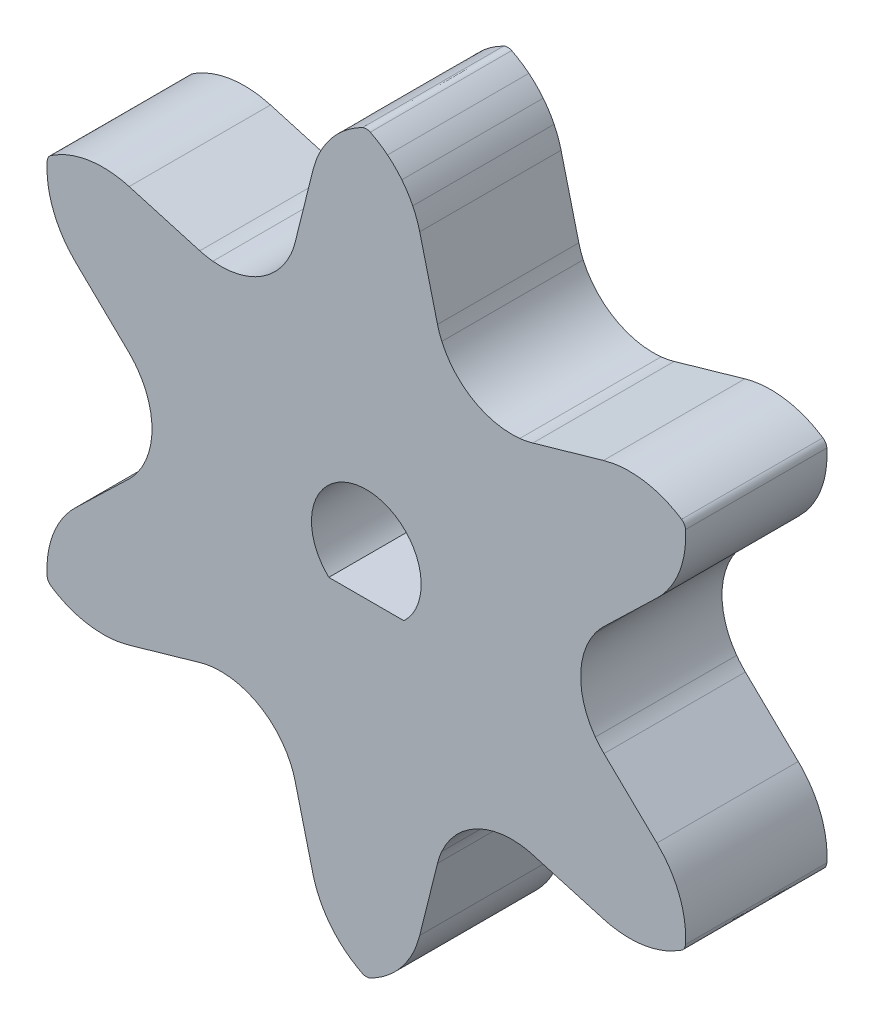
from build123d import *

# Parameters (mm, degrees)
BOSS_EXTRUDE1_DEPTH = 4.7625
BOSS_EXTRUDE2_START = -4.7625
BOSS_EXTRUDE2_DEPTH = 4.7625


with BuildPart() as part:
    # Sketch1 → Boss-Extrude1 (new body)
    with BuildSketch(Plane.XY):
        with BuildLine():
            Line((-9.507346898, -10.258391726), (-8.908113007, -12.661787593))
            ThreePointArc((-8.908113007, -12.661787593), (-8.303157018, -13.881491249), (-7.2429575, -14.735672577))
            ThreePointArc((-7.2429575, -14.735672577), (-7.10920631, -14.767138372), (-6.975455121, -14.735672577))
            ThreePointArc((-6.975455121, -14.735672577), (-5.915255603, -13.881491249), (-5.310299614, -12.661787593))
            Line((-5.310299614, -12.661787593), (-4.711065722, -10.258391726))
            ThreePointArc((-4.711065722, -10.258391726), (-4.647570891, -10.043856855), (-4.565714834, -9.835634882))
            ThreePointArc((-4.565714834, -9.835634882), (-3.49859631, -8.649390472), (-1.937719254, -8.318360926))
            ThreePointArc((-1.937719254, -8.318360926), (-1.716465707, -8.351582488), (-1.498925643, -8.403861787))
            Line((-1.498925643, -8.403861787), (0.882093179, -9.086607947))
            ThreePointArc((0.882093179, -9.086607947), (2.240865525, -9.172552521), (3.510708013, -8.681483469))
            ThreePointArc((3.510708013, -8.681483469), (3.604833786, -8.581384439), (3.644459203, -8.449819613))
            ThreePointArc((3.644459203, -8.449819613), (3.434816232, -7.104569234), (2.680999875, -5.970810151))
            Line((2.680999875, -5.970810151), (0.899214945, -4.250160445))
            ThreePointArc((0.899214945, -4.250160445), (0.745169712, -4.087904873), (0.605772222, -3.912904461))
            ThreePointArc((0.605772222, -3.912904461), (0.11201369, -2.395630505), (0.605772222, -0.878356549))
            ThreePointArc((0.605772222, -0.878356549), (0.745169712, -0.703356138), (0.899214945, -0.541100566))
            Line((0.899214945, -0.541100566), (2.680999444, 1.179548724))
            ThreePointArc((2.680999444, 1.179548724), (3.434816124, 2.313307944), (3.644459203, 3.658558603))
            ThreePointArc((3.644459203, 3.658558603), (3.604833786, 3.790123428), (3.510708013, 3.890222459))
            ThreePointArc((3.510708013, 3.890222459), (2.240865525, 4.38129151), (0.882093179, 4.295346937))
            Line((0.882093179, 4.295346937), (-1.498925643, 3.612600776))
            ThreePointArc((-1.498925643, 3.612600776), (-1.716465707, 3.560321477), (-1.937719254, 3.527099916))
            ThreePointArc((-1.937719254, 3.527099916), (-3.49859631, 3.858129461), (-4.565714834, 5.044373871))
            ThreePointArc((-4.565714834, 5.044373871), (-4.647570891, 5.252595845), (-4.711065722, 5.467130715))
            Line((-4.711065722, 5.467130715), (-5.310299614, 7.870526582))
            ThreePointArc((-5.310299614, 7.870526582), (-5.915255603, 9.090230239), (-6.975455121, 9.944411567))
            ThreePointArc((-6.975455121, 9.944411567), (-7.10920631, 9.975877362), (-7.2429575, 9.944411567))
            ThreePointArc((-7.2429575, 9.944411567), (-8.303157018, 9.090230239), (-8.908113007, 7.870526582))
            Line((-8.908113007, 7.870526582), (-9.507346898, 5.467130715))
            ThreePointArc((-9.507346898, 5.467130715), (-9.570841729, 5.252595845), (-9.652697786, 5.044373871))
            ThreePointArc((-9.652697786, 5.044373871), (-10.71981631, 3.858129461), (-12.280693367, 3.527099916))
            ThreePointArc((-12.280693367, 3.527099916), (-12.501946914, 3.560321477), (-12.719486977, 3.612600776))
            Line((-12.719486977, 3.612600776), (-15.100505799, 4.295346937))
            ThreePointArc((-15.100505799, 4.295346937), (-16.459278145, 4.38129151), (-17.729120634, 3.890222459))
            ThreePointArc((-17.729120634, 3.890222459), (-17.823246406, 3.790123428), (-17.862871823, 3.658558603))
            ThreePointArc((-17.862871823, 3.658558603), (-17.653228853, 2.313308223), (-16.899412496, 1.17954914))
            Line((-16.899412496, 1.17954914), (-15.117627565, -0.541100566))
            ThreePointArc((-15.117627565, -0.541100566), (-14.963582333, -0.703356138), (-14.824184843, -0.878356549))
            ThreePointArc((-14.824184843, -0.878356549), (-14.33042631, -2.395630505), (-14.824184843, -3.912904461))
            ThreePointArc((-14.824184843, -3.912904461), (-14.963582333, -4.087904873), (-15.117627565, -4.250160445))
            Line((-15.117627565, -4.250160445), (-16.899412065, -5.970809735))
            ThreePointArc((-16.899412065, -5.970809735), (-17.653228744, -7.104568955), (-17.862871823, -8.449819613))
            ThreePointArc((-17.862871823, -8.449819613), (-17.823246406, -8.581384439), (-17.729120634, -8.681483469))
            ThreePointArc((-17.729120634, -8.681483469), (-16.459278145, -9.172552521), (-15.100505799, -9.086607947))
            Line((-15.100505799, -9.086607947), (-12.719486977, -8.403861787))
            ThreePointArc((-12.719486977, -8.403861787), (-12.501946914, -8.351582488), (-12.280693367, -8.318360926))
            ThreePointArc((-12.280693367, -8.318360926), (-10.71981631, -8.649390472), (-9.652697786, -9.835634882))
            ThreePointArc((-9.652697786, -9.835634882), (-9.570841729, -10.043856855), (-9.507346898, -10.258391726))
        make_face()
        with BuildLine():
            Line((-5.795813757, -3.870630505), (-8.422598864, -3.870630505))
            ThreePointArc((-8.422598864, -3.870630505), (-7.10920631, -0.420630505), (-5.795813757, -3.870630505))
        make_face(mode=Mode.SUBTRACT)
    extrude(amount=BOSS_EXTRUDE1_DEPTH)

    # Sketch4 → Boss-Extrude2 (add)
    with BuildSketch(Plane.XY.offset(4.7625).offset(BOSS_EXTRUDE2_START)):
        with BuildLine():
            Line((-8.422598864, -3.870630505), (-5.795813757, -3.870630505))
            ThreePointArc((-5.795813757, -3.870630505), (-7.10920631, -0.420630505), (-8.422598864, -3.870630505))
        make_face()
        with BuildLine():
            Line((-8.373326558, -3.743630505), (-5.845086063, -3.743630505))
            ThreePointArc((-5.845086063, -3.743630505), (-7.10920631, -0.547630505), (-8.373326558, -3.743630505))
        make_face(mode=Mode.SUBTRACT)
    extrude(amount=BOSS_EXTRUDE2_DEPTH)


solid = part.part
